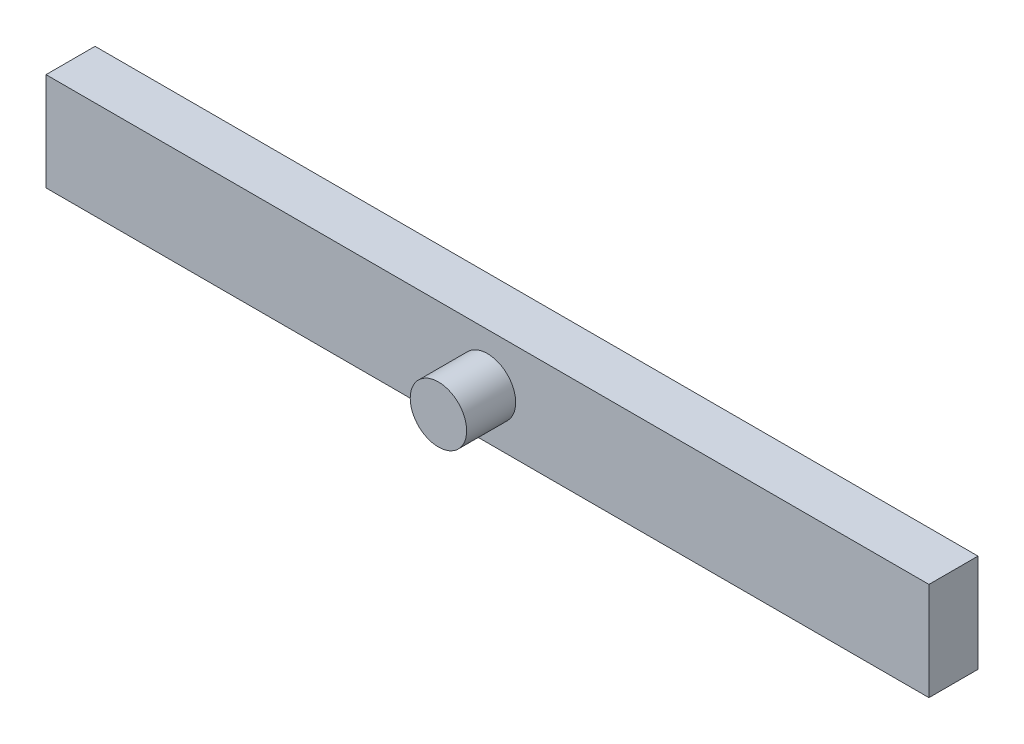
from build123d import *

# Parameters (mm, degrees)
BOSS_EXTRUDE2_DEPTH = 5
SKETCH2_R           = 2.875
BOSS_EXTRUDE3_DEPTH = 5


with BuildPart() as part:
    # Sketch1 → Boss-Extrude2 (new body)
    with BuildSketch(Plane.XY):
        Polygon((0, 5), (45, 5), (45, -5), (-45, -5), (-45, 5), align=None)
    extrude(amount=-BOSS_EXTRUDE2_DEPTH)

    # Sketch2 → Boss-Extrude3 (add)
    with BuildSketch(Plane.XY):
        with Locations(Location((0, 0, 0), (0, 0, 180))):
            Circle(SKETCH2_R)
    extrude(amount=BOSS_EXTRUDE3_DEPTH)


solid = part.part
